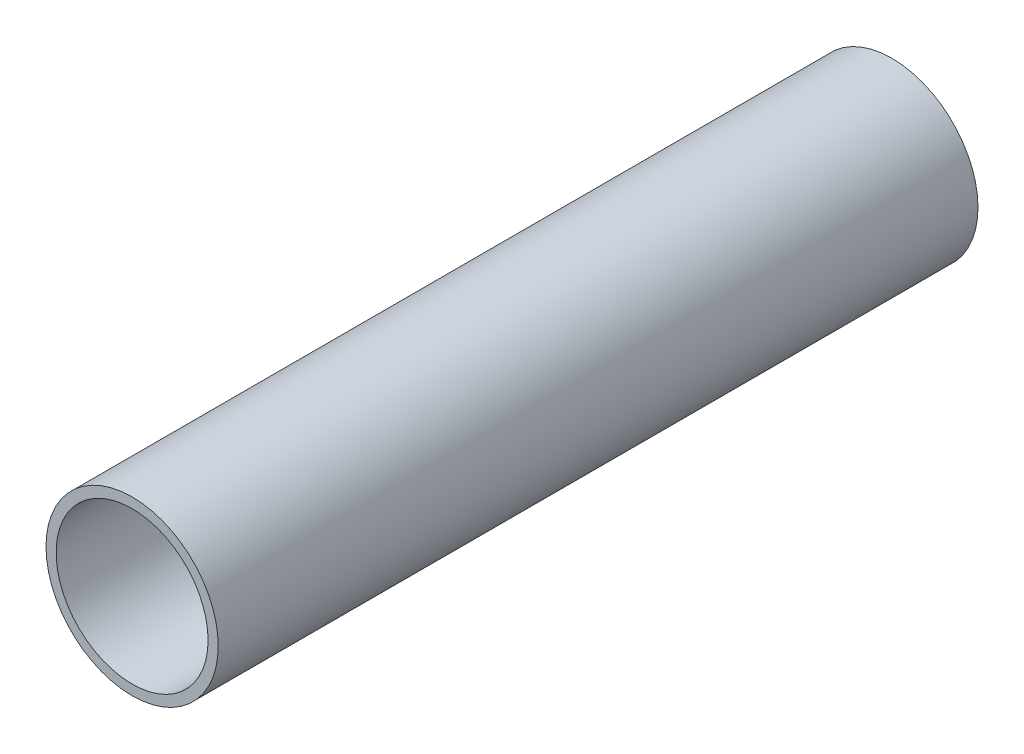
from build123d import *

# Parameters (mm, degrees)
SKETCH1_R           = 34
SKETCH1_R_2         = 30
BOSS_EXTRUDE1_DEPTH = 300


with BuildPart() as part:
    # Sketch1 → Boss-Extrude1 (new body)
    with BuildSketch(Plane.XY):
        Circle(SKETCH1_R)
        Circle(SKETCH1_R_2, mode=Mode.SUBTRACT)
    extrude(amount=BOSS_EXTRUDE1_DEPTH)


solid = part.part
